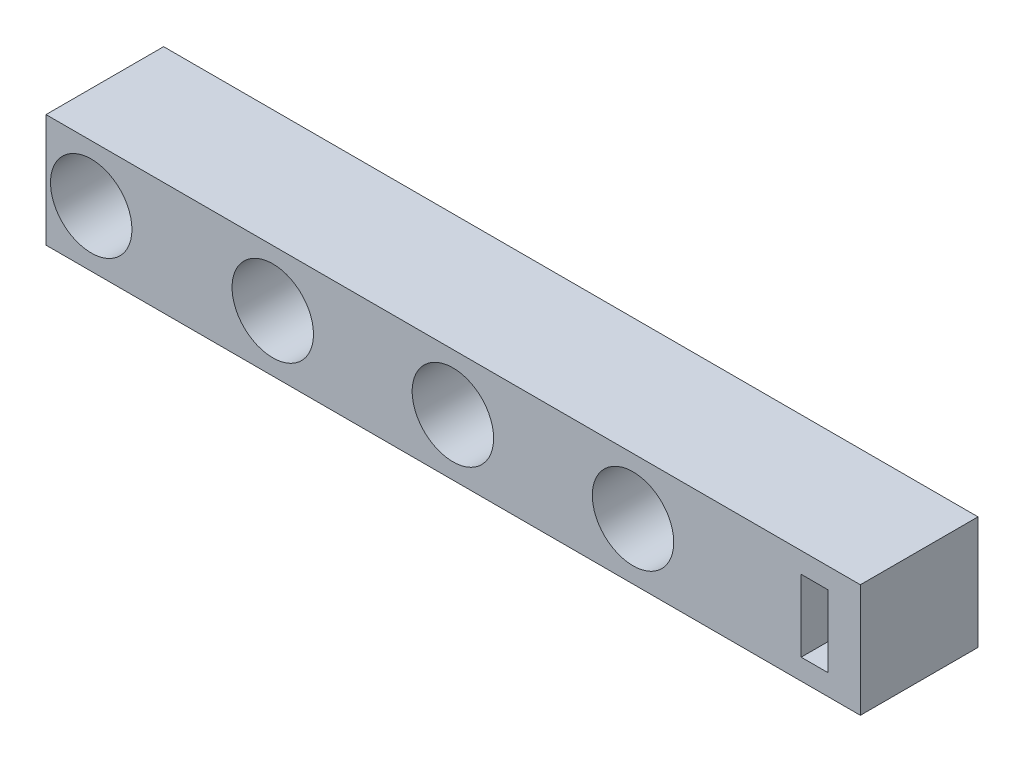
from build123d import *

# Parameters (mm, degrees)
SKIZZE1_W                        = 180
SKIZZE1_H                        = 25
AUFSATZ_LINEAR_AUSTRAGEN1_DEPTH  = 26
F_18_0_18_DURCHMESSER_BOHRUNG2_D = 18
SKIZZE9_W                        = 5.897581214
SKIZZE9_H                        = 15.867301838
SCHNITT_LINEAR_AUSTRAGEN1_DEPTH  = 184.57832116


with BuildPart() as part:
    # Skizze1 → Aufsatz-Linear austragen1 (new body)
    with BuildSketch(Plane.XY):
        with Locations((90, 12.5)):
            Rectangle(SKIZZE1_W, SKIZZE1_H)
    extrude(amount=AUFSATZ_LINEAR_AUSTRAGEN1_DEPTH)

    # Ø18.0 (18) Durchmesser Bohrung2 (through all)
    with Locations(Plane.XY.offset(26)):
        with Locations((9.995618269, 12.5), (50.121303026, 12.5), (89.934725645, 12.5), (129.748148264, 12.5)):
            Hole(F_18_0_18_DURCHMESSER_BOHRUNG2_D / 2)

    # Skizze9 → Schnitt-Linear austragen1 (cut, through all)
    with BuildSketch(Plane.XY.offset(26)):
        with Locations((169.861933283, 12.524643843)):
            Rectangle(SKIZZE9_W, SKIZZE9_H)
    extrude(amount=-SCHNITT_LINEAR_AUSTRAGEN1_DEPTH, mode=Mode.SUBTRACT)


solid = part.part
